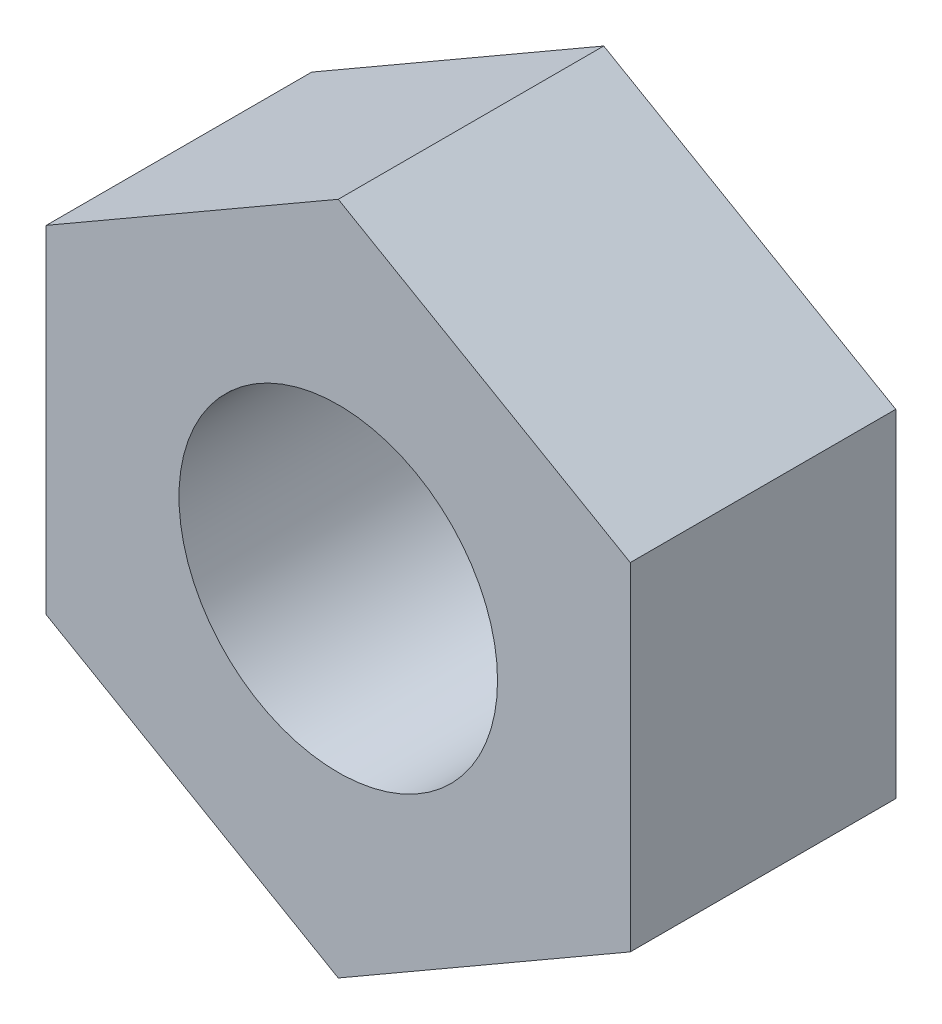
from build123d import *

# Parameters (mm, degrees)
SKETCH1_R           = 1.5
BOSS_EXTRUDE1_DEPTH = 2.5


with BuildPart() as part:
    # Sketch1 → Boss-Extrude1 (new body)
    with BuildSketch(Plane.XY):
        Polygon((2.75, -1.58771324), (2.75, 1.58771324), (0, 3.175426481), (-2.75, 1.58771324), (-2.75, -1.58771324), (0, -3.175426481), align=None)
        Circle(SKETCH1_R, mode=Mode.SUBTRACT)
    extrude(amount=BOSS_EXTRUDE1_DEPTH)


solid = part.part
